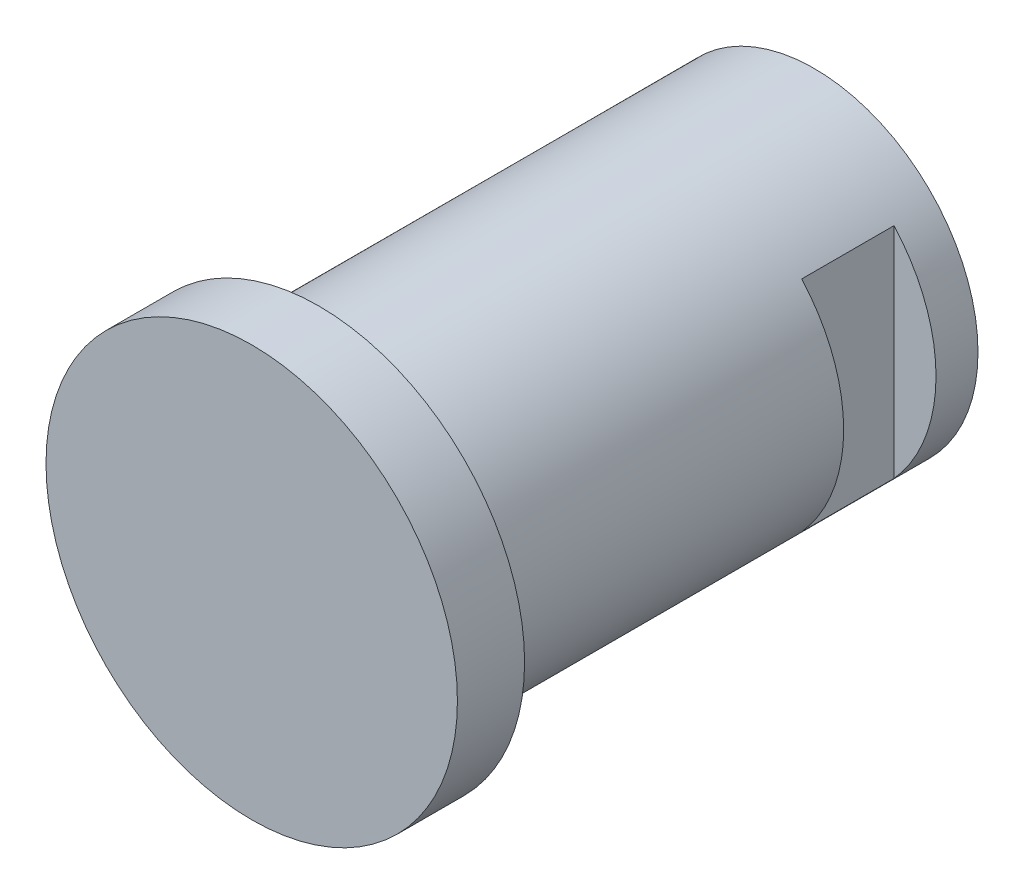
from build123d import *

# Parameters (mm, degrees)
SKETCH1_R               = 4.953
BOSS_EXTRUDE1_DEPTH     = 17.018
SKETCH2_R               = 6.223
BOSS_EXTRUDE2_DEPTH     = 2.032
CUT_EXTRUDE1_DEPTH      = 20.158908685
CUT_EXTRUDE1_DEPTH_BACK = 20.158908685
SKETCH3_W               = 1.27
SKETCH3_H               = 2.794


with BuildPart() as part:
    # Sketch1 → Boss-Extrude1 (new body)
    with BuildSketch(Plane.XY):
        Circle(SKETCH1_R)
    extrude(amount=BOSS_EXTRUDE1_DEPTH)

    # Sketch2 → Boss-Extrude2 (add)
    with BuildSketch(Plane.XY.offset(17.018)):
        Circle(SKETCH2_R)
    extrude(amount=-BOSS_EXTRUDE2_DEPTH)

    # Sketch3 → Cut-Extrude1 (cut, two sides: drawn at the far end of the back side and taken through both)
    with BuildSketch(Plane(origin=(0, 0, 0), x_dir=(1, 0, 0), z_dir=(0, 1, 0)).offset(-CUT_EXTRUDE1_DEPTH_BACK)):
        with Locations((4.318, -2.667)):
            Rectangle(SKETCH3_W, SKETCH3_H)
        with Locations((-4.318, -2.667)):
            Rectangle(SKETCH3_W, SKETCH3_H)
    extrude(amount=CUT_EXTRUDE1_DEPTH + CUT_EXTRUDE1_DEPTH_BACK, mode=Mode.SUBTRACT)


solid = part.part
